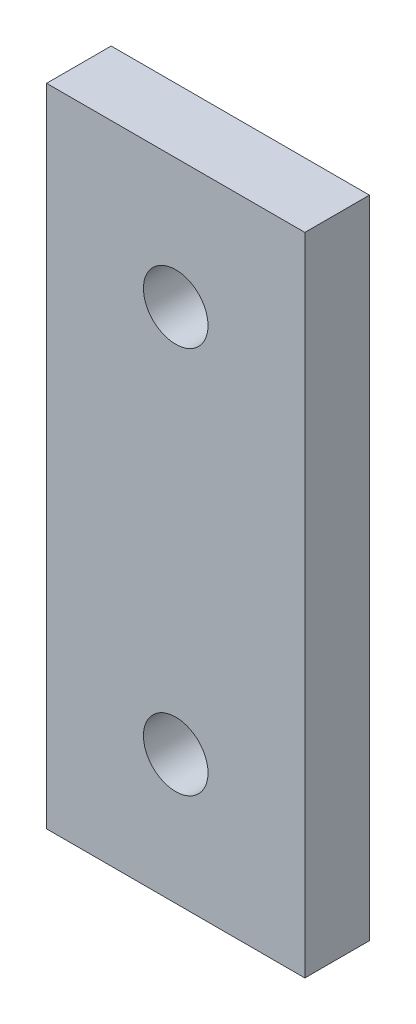
from build123d import *

# Parameters (mm, degrees)
SKETCH_1_W          = 20
SKETCH_1_H          = 50
EXTRUDE_1_DEPTH     = 5
SKETCH_2_R          = 2.5
CUT_EXTRUDE_1_DEPTH = 28.386127875


with BuildPart() as part:
    # 草图1 → 凸台-拉伸1 (new body)
    with BuildSketch(Plane.XY):
        Rectangle(SKETCH_1_W, SKETCH_1_H)
    extrude(amount=EXTRUDE_1_DEPTH)

    # 草图2 → 切除-拉伸1 (cut, through all)
    with BuildSketch(Plane.XY.offset(5)):
        with Locations((0, 15)):
            Circle(SKETCH_2_R)
        with Locations((0, -15)):
            Circle(SKETCH_2_R)
    extrude(amount=-CUT_EXTRUDE_1_DEPTH, mode=Mode.SUBTRACT)


solid = part.part
